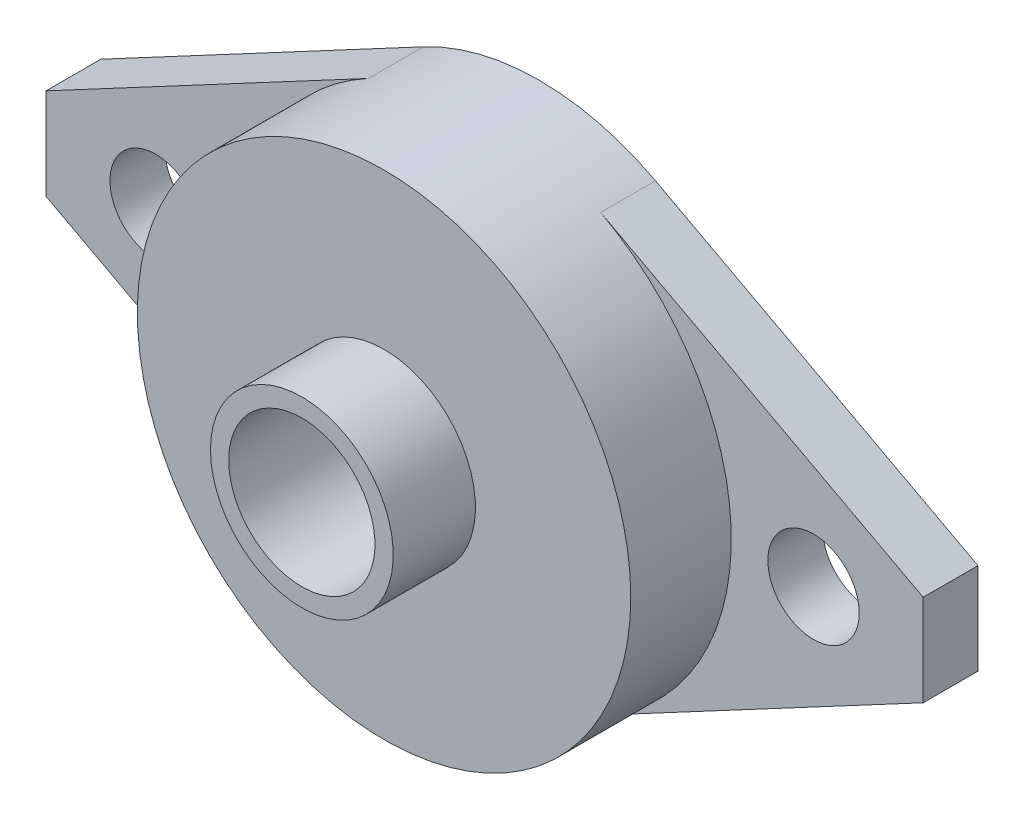
from build123d import *

# Parameters (mm, degrees)
SKETCH_1_R      = 2.5
SKETCH_1_R_2    = 5
EXTRUDE_1_DEPTH = 3
SKETCH_1_3_R    = 5
EXTRUDE_2_DEPTH = 8.5
SKETCH_1_4_R    = 5
SKETCH_1_4_R_2  = 4
EXTRUDE_3_DEPTH = 13


with BuildPart() as part:
    # 草图1 → 凸台-拉伸1 (new body)
    with BuildSketch(Plane.XY):
        with BuildLine():
            Line((-24, 2.5), (-24, -2.5))
            Line((-24, -2.5), (-6.352941176, -11.911764706))
            ThreePointArc((-6.352941176, -11.911764706), (0, -13.5), (6.352941176, -11.911764706))
            Line((6.352941176, -11.911764706), (24, -2.5))
            Line((24, -2.5), (24, 2.5))
            Line((24, 2.5), (6.352941176, 11.911764706))
            ThreePointArc((6.352941176, 11.911764706), (0, 13.5), (-6.352941176, 11.911764706))
            Line((-6.352941176, 11.911764706), (-24, 2.5))
        make_face()
        with Locations((-18, 0)):
            Circle(SKETCH_1_R, mode=Mode.SUBTRACT)
        Circle(SKETCH_1_R_2, mode=Mode.SUBTRACT)
        with Locations((18, 0)):
            Circle(SKETCH_1_R, mode=Mode.SUBTRACT)
    extrude(amount=EXTRUDE_1_DEPTH)

    # 草图1<3> → 凸台-拉伸2 (add)
    with BuildSketch(Plane.XY):
        with BuildLine():
            ThreePointArc((-6.352941176, 11.911764706), (-13.5, 0), (-6.352941176, -11.911764706))
            ThreePointArc((-6.352941176, -11.911764706), (0, -13.5), (6.352941176, -11.911764706))
            ThreePointArc((6.352941176, -11.911764706), (11.576154497, -6.945692698), (13.5, 0))
            ThreePointArc((13.5, 0), (11.576154497, 6.945692698), (6.352941176, 11.911764706))
            ThreePointArc((6.352941176, 11.911764706), (0, 13.5), (-6.352941176, 11.911764706))
        make_face()
        Circle(SKETCH_1_3_R, mode=Mode.SUBTRACT)
    extrude(amount=EXTRUDE_2_DEPTH)

    # 草图1<4> → 凸台-拉伸3 (add)
    with BuildSketch(Plane.XY):
        Circle(SKETCH_1_4_R)
        Circle(SKETCH_1_4_R_2, mode=Mode.SUBTRACT)
    extrude(amount=EXTRUDE_3_DEPTH)


solid = part.part
